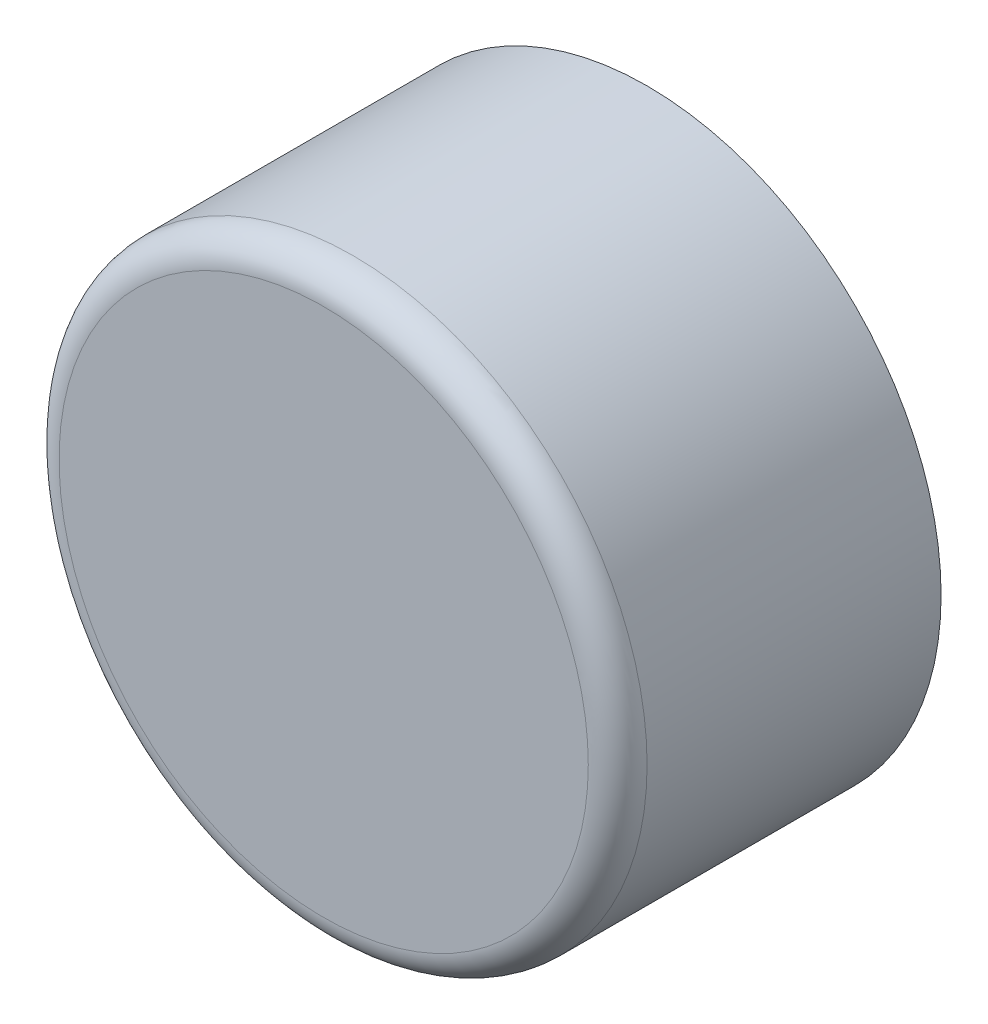
from build123d import *

# Parameters (mm, degrees)
SKETCH1_R           = 20
SKETCH1_R_2         = 17
BOSS_EXTRUDE1_DEPTH = 20
SKETCH2_R           = 20
BOSS_EXTRUDE2_DEPTH = 2
FILLET1_R           = 2


with BuildPart() as part:
    # Sketch1 → Boss-Extrude1 (new body)
    with BuildSketch(Plane.XY):
        Circle(SKETCH1_R)
        Circle(SKETCH1_R_2, mode=Mode.SUBTRACT)
    extrude(amount=BOSS_EXTRUDE1_DEPTH)

    # Sketch2 → Boss-Extrude2 (add)
    with BuildSketch(Plane.XY.offset(20)):
        Circle(SKETCH2_R)
    extrude(amount=BOSS_EXTRUDE2_DEPTH)

    # Fillet1
    fillet1_edges = [part.edges().sort_by_distance(p)[0] for p in [
        (-20, 0, 22),
    ]]
    fillet(fillet1_edges, radius=FILLET1_R)


solid = part.part
